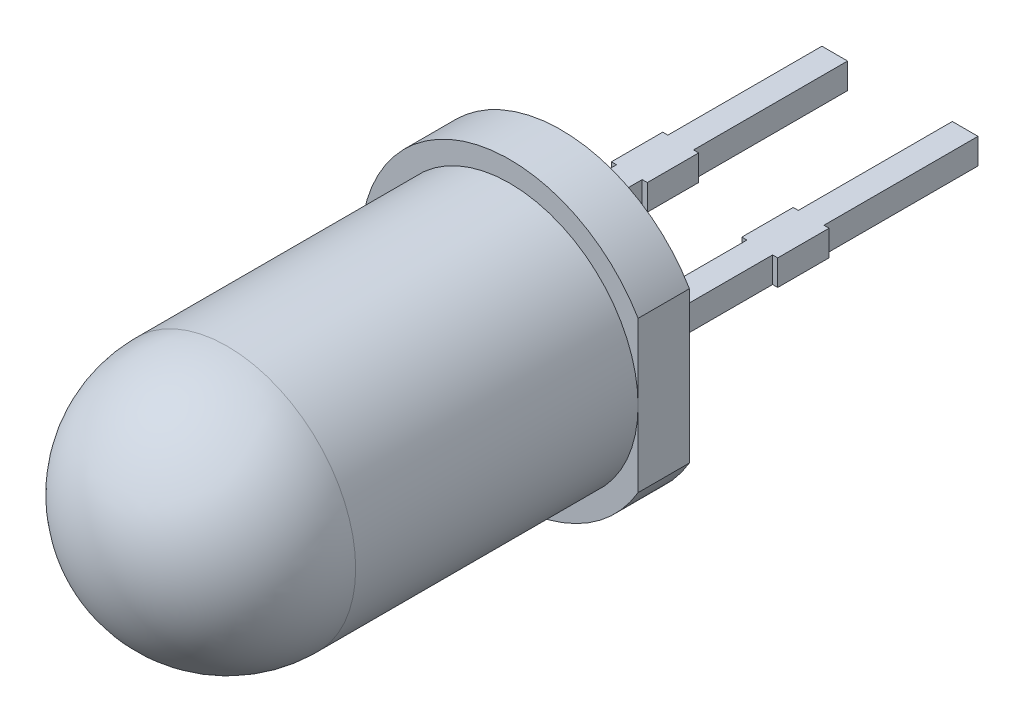
from build123d import *

# Parameters (mm, degrees)
EXTRUDE_1_DEPTH     = 0.25
EXTRUDE_1_2_DEPTH   = 0.25
CUT_EXTRUDE_1_REACH = 10.99


with BuildPart() as part:
    # Эскиз1 → Бобышка-Вытянуть1 (new, symmetric)
    with BuildSketch(Plane.XZ):
        Polygon((-1.52, 3.6), (-1.52, 1), (-1.62, 1), (-1.62, 0), (-1.52, 0), (-1.52, -3), (-1.02, -3), (-1.02, 0), (-0.92, 0), (-0.92, 1), (-1.02, 1), (-1.02, 3.6), align=None)
    extrude(amount=EXTRUDE_1_DEPTH, both=True)



with BuildPart() as body_2:
    # Эскиз1 → Extrude 1 2 (new, symmetric)
    with BuildSketch(Plane.XZ):
        Polygon((1.02, 3.6), (1.02, 1), (0.92, 1), (0.92, 0), (1.02, 0), (1.02, -3), (1.52, -3), (1.52, 0), (1.62, 0), (1.62, 1), (1.52, 1), (1.52, 3.6), align=None)
    extrude(amount=EXTRUDE_1_2_DEPTH, both=True)


with BuildPart() as part_1:
    add(part.part)

    add(body_2.part)  # Повернуть1 merges body 2
    # Эскиз2 → Повернуть1 (revolve)
    with BuildSketch(Plane(origin=(0, 0, 0), x_dir=(1, 0, 0), z_dir=(0, 1, 0))):
        with BuildLine():
            Line((0, -3.6), (0, -12.6))
            ThreePointArc((0, -12.6), (1.767766953, -11.867766953), (2.5, -10.1))
            Line((2.5, -10.1), (2.5, -4.6))
            Line((2.5, -4.6), (2.9, -4.6))
            Line((2.9, -4.6), (2.9, -3.6))
            Line((2.9, -3.6), (0, -3.6))
        make_face()
    revolve(axis=Axis((0, 0, 3.6), (0, 0, -1)))

    # Эскиз3 → Вырез-Вытянуть1 (cut, up to next)
    with BuildSketch(Plane.XY.offset(4.6), mode=Mode.PRIVATE) as cut_extrude_1_sk1:
        with BuildLine():
            Line((2.5, 1.469693846), (2.5, -1.469693846))
            ThreePointArc((2.5, -1.469693846), (2.9, 0), (2.5, 1.469693846))
        make_face()
    cut_extrude_1_tool1 = extrude(cut_extrude_1_sk1.sketch, amount=-CUT_EXTRUDE_1_REACH, mode=Mode.PRIVATE) & part_1.part
    add(cut_extrude_1_tool1.solids().sort_by_distance((2.660985, 0, 4.6))[0], mode=Mode.SUBTRACT)


solid = part_1.part
